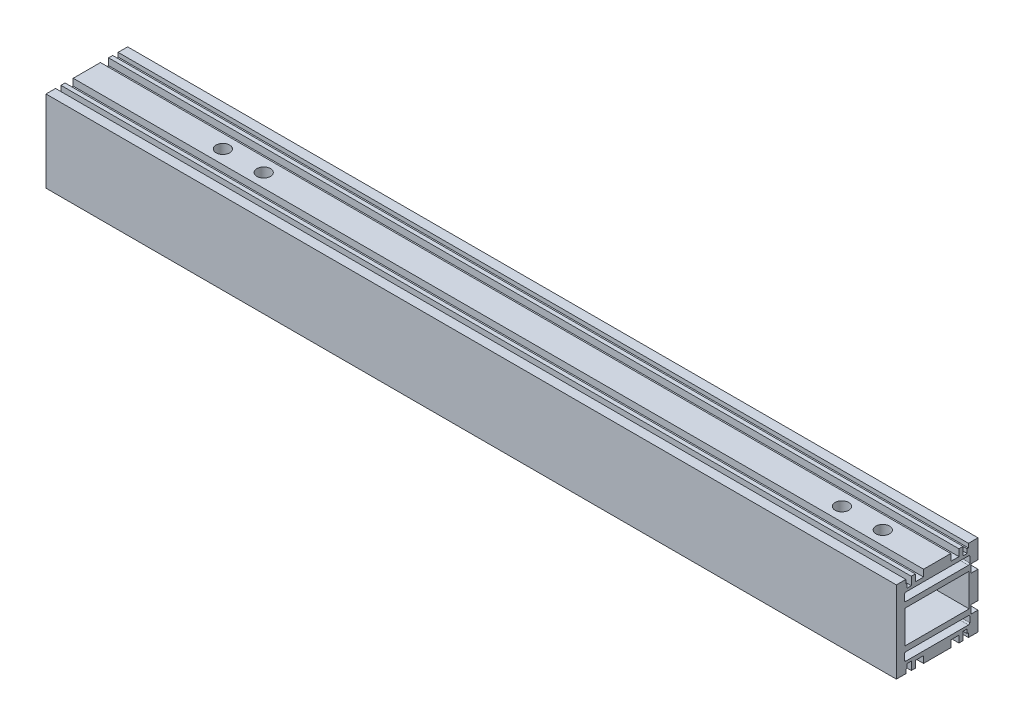
from build123d import *

# Parameters (mm, degrees)
SKETCH_1_W             = 23.5
SKETCH_1_H             = 12
EXTRUDE_1_DEPTH        = 156.25
HOLE_WIZARD_M6_1_D     = 5
HOLE_WIZARD_M6_1_DEPTH = 19
HOLE_WIZARD_M6_1_TIP   = 1.502151548


with BuildPart() as part:
    # 草图1 → 凸台-拉伸1 (new, symmetric)
    with BuildSketch(Plane(origin=(0, 0, 0), x_dir=(0, 0, -1), z_dir=(1, 0, 0))):
        Polygon((-15, 15), (-11.5, 15), (-11.5, 13.5), (-11, 13.5), (-11, 12), (-9.5, 12), (-9.5, 15), (-8, 15), (-8, 12.5), (-5, 12.5), (-5, 15), (5, 15), (5, 12.5), (8, 12.5), (8, 15), (9.5, 15), (9.5, 12), (11, 12), (11, 13.5), (11.5, 13.5), (11.5, 15), (15, 15), (15, 8), (12.5, 8), (12.5, 5), (15, 5), (15, -5), (12.5, -5), (12.5, -8), (15, -8), (15, -15), (11.5, -15), (11.5, -13.5), (11, -13.5), (11, -12), (9.5, -12), (9.5, -15), (8, -15), (8, -12.5), (5, -12.5), (5, -15), (-5, -15), (-5, -12.5), (-8, -12.5), (-8, -15), (-9.5, -15), (-9.5, -12), (-11, -12), (-11, -13.5), (-11.5, -13.5), (-11.5, -15), (-15, -15), align=None)
        with BuildLine():
            Line((12, -10.5), (12, -8.5))
            ThreePointArc((12, -8.5), (11.853553391, -8.146446609), (11.5, -8))
            Line((11.5, -8), (-11.5, -8))
            ThreePointArc((-11.5, -8), (-11.853553391, -8.146446609), (-12, -8.5))
            Line((-12, -8.5), (-12, -10.5))
            ThreePointArc((-12, -10.5), (-11.853553391, -10.853553391), (-11.5, -11))
            Line((-11.5, -11), (11.5, -11))
            ThreePointArc((11.5, -11), (11.853553391, -10.853553391), (12, -10.5))
        make_face(mode=Mode.SUBTRACT)
        with BuildLine():
            Line((-11.5, 11), (11.5, 11))
            ThreePointArc((11.5, 11), (11.853553391, 10.853553391), (12, 10.5))
            Line((12, 10.5), (12, 8.5))
            ThreePointArc((12, 8.5), (11.853553391, 8.146446609), (11.5, 8))
            Line((11.5, 8), (-11.5, 8))
            ThreePointArc((-11.5, 8), (-11.853553391, 8.146446609), (-12, 8.5))
            Line((-12, 8.5), (-12, 10.5))
            ThreePointArc((-12, 10.5), (-11.853553391, 10.853553391), (-11.5, 11))
        make_face(mode=Mode.SUBTRACT)
        Rectangle(SKETCH_1_W, SKETCH_1_H, mode=Mode.SUBTRACT)
    extrude(amount=EXTRUDE_1_DEPTH, both=True)

    # M6 螺纹孔1
    with Locations(Plane(origin=(0, 15, 0), x_dir=(1, 0, 0), z_dir=(0, 1, 0))):
        with Locations((136.25, 0), (121.25, 0), (-91.25, 0), (-106.25, 0)):
            Hole(HOLE_WIZARD_M6_1_D / 2, depth=HOLE_WIZARD_M6_1_DEPTH)
            with Locations((0, 0, -(HOLE_WIZARD_M6_1_DEPTH + HOLE_WIZARD_M6_1_TIP / 2))):  # 118° drill point
                Cone(0, HOLE_WIZARD_M6_1_D / 2, HOLE_WIZARD_M6_1_TIP, mode=Mode.SUBTRACT)


solid = part.part
